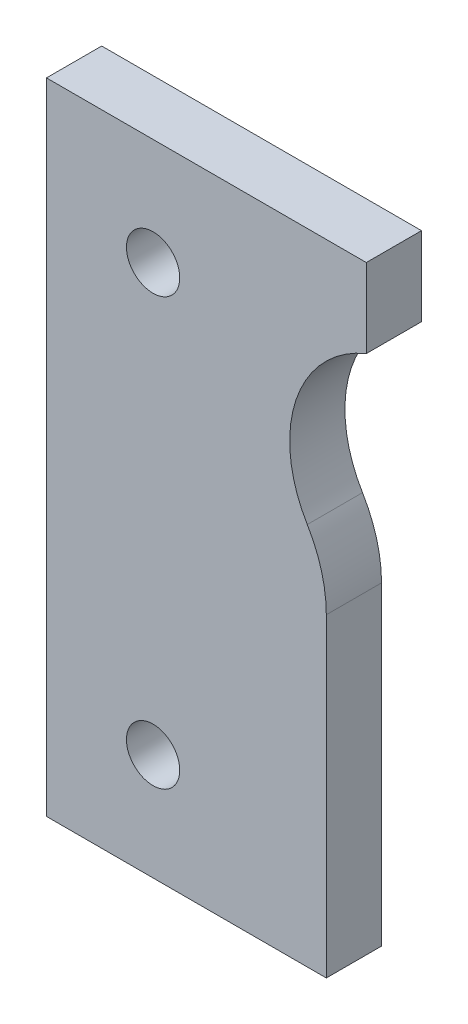
from build123d import *

# Parameters (mm, degrees)
BOSS_EXTRUDE1_DEPTH        = 6.5786
F_97_0_25_DIAMETER_HOLE1_D = 6.35


with BuildPart() as part:
    # Sketch2 → Boss-Extrude1 (new body)
    with BuildSketch(Plane.XY):
        with BuildLine():
            Line((-16.66875, -15.734319794), (-16.66875, -39.617329943))
            Line((-16.66875, -39.617329943), (-16.66875, -49.389319794))
            Line((-16.66875, -49.389319794), (-16.66875, -53.212823447))
            Line((-16.66875, -53.212823447), (-50.00625, -53.212823447))
            Line((-50.00625, -53.212823447), (-50.00625, 22.987176553))
            Line((-50.00625, 22.987176553), (-11.90625, 22.987176553))
            Line((-11.90625, 22.987176553), (-11.90625, 13.589176553))
            ThreePointArc((-11.90625, 13.589176553), (-20.281897601, 4.630319933), (-18.935193267, -7.559797873))
            ThreePointArc((-18.935193267, -7.559797873), (-17.24585042, -11.492870345), (-16.66875, -15.734319794))
        make_face()
    extrude(amount=BOSS_EXTRUDE1_DEPTH)

    # #97 (0.25) Diameter Hole1 (through all)
    with Locations(Plane(origin=(-37.30625, 10.287176553, 6.5786), x_dir=(1, 0, 0), z_dir=(0, 0, 1))):
        with Locations((0, 0), (0, -50.8)):
            Hole(F_97_0_25_DIAMETER_HOLE1_D / 2)


solid = part.part
